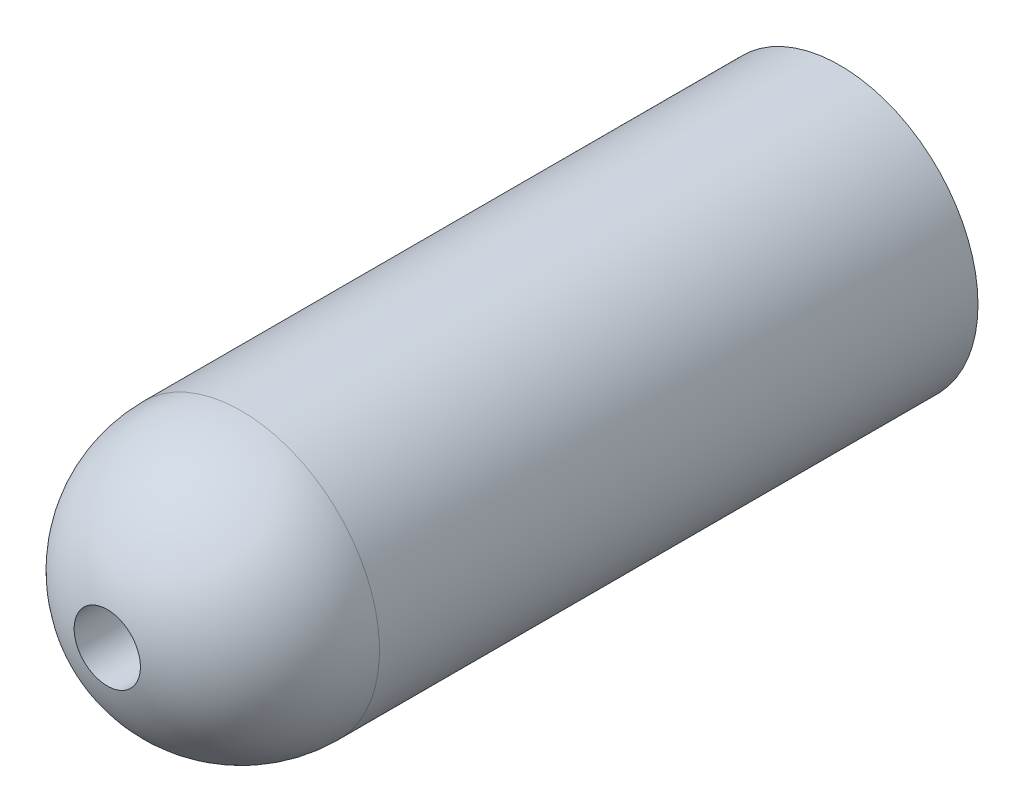
from build123d import *

# Parameters (mm, degrees)
SKETCH1_R           = 4.7625
BOSS_EXTRUDE1_DEPTH = 25.4
FILLET1_R           = 4.7625
SKETCH2_R           = 1.143
CUT_EXTRUDE1_DEPTH  = 25.4


with BuildPart() as part:
    # Sketch1 → Boss-Extrude1 (new body)
    with BuildSketch(Plane.XY):
        Circle(SKETCH1_R)
    extrude(amount=BOSS_EXTRUDE1_DEPTH)

    # Fillet1
    fillet1_edges = [part.edges().sort_by_distance(p)[0] for p in [
        (-4.7625, 0, 25.4),
    ]]
    fillet(fillet1_edges, radius=FILLET1_R)

    # Sketch2 → Cut-Extrude1 (cut)
    with BuildSketch(Plane(origin=(0, 0, 0), x_dir=(-1, 0, 0), z_dir=(0, 0, -1))):
        Circle(SKETCH2_R)
    extrude(amount=-CUT_EXTRUDE1_DEPTH, mode=Mode.SUBTRACT)


solid = part.part
